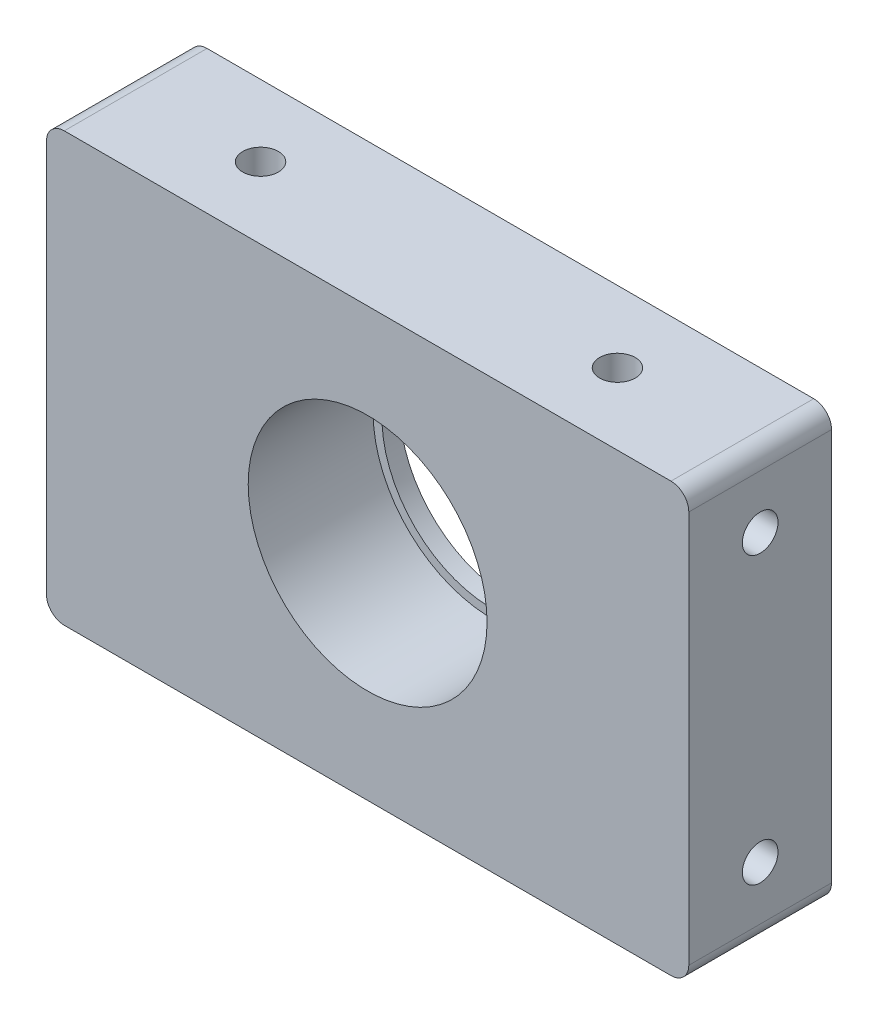
from build123d import *

# Parameters (mm, degrees)
BOSS_EXTRUDE1_DEPTH = 25.4
SKETCH2_R           = 42.50055
CUT_EXTRUDE1_DEPTH  = 44.45
SKETCH3_R           = 39.37
CUT_EXTRUDE2_DEPTH  = 31.75
SKETCH4_R           = 6.35
CUT_EXTRUDE3_DEPTH  = 19.05
CUT_EXTRUDE4_START  = -19.05
SKETCH5_R           = 6.35
CUT_EXTRUDE4_DEPTH  = 19.05
SKETCH6_R           = 6.35
CUT_EXTRUDE5_DEPTH  = 19.05
CUT_EXTRUDE6_START  = -19.05
SKETCH7_R           = 6.35
CUT_EXTRUDE6_DEPTH  = 19.05


with BuildPart() as part:
    # Sketch1 → Boss-Extrude1 (new, symmetric)
    with BuildSketch(Plane.XY):
        with BuildLine():
            Line((-107.95, -76.2), (107.95, -76.2))
            ThreePointArc((107.95, -76.2), (112.440128061, -74.340128061), (114.3, -69.85))
            Line((114.3, -69.85), (114.3, 69.85))
            ThreePointArc((114.3, 69.85), (112.440128061, 74.340128061), (107.95, 76.2))
            Line((107.95, 76.2), (-107.95, 76.2))
            ThreePointArc((-107.95, 76.2), (-112.440128061, 74.340128061), (-114.3, 69.85))
            Line((-114.3, 69.85), (-114.3, -69.85))
            ThreePointArc((-114.3, -69.85), (-112.440128061, -74.340128061), (-107.95, -76.2))
        make_face()
    extrude(amount=BOSS_EXTRUDE1_DEPTH, both=True)

    # Sketch2 → Cut-Extrude1 (cut)
    with BuildSketch(Plane.XY.offset(25.4)):
        Circle(SKETCH2_R)
    extrude(amount=-CUT_EXTRUDE1_DEPTH, mode=Mode.SUBTRACT)

    # Sketch3 → Cut-Extrude2 (cut)
    with BuildSketch(Plane.XY.offset(-19.05)):
        Circle(SKETCH3_R)
    extrude(amount=-CUT_EXTRUDE2_DEPTH, mode=Mode.SUBTRACT)

    # Sketch4 → Cut-Extrude3 (cut)
    with BuildSketch(Plane(origin=(0, 76.2, 0), x_dir=(1, 0, 0), z_dir=(0, 1, 0))):
        with Locations(Location((-63.5, 0, 0), (0, 0, 270))):
            Circle(SKETCH4_R)
        with Locations(Location((63.5, 0, 0), (0, 0, 270))):
            Circle(SKETCH4_R)
    extrude(amount=-CUT_EXTRUDE3_DEPTH, mode=Mode.SUBTRACT)

    # Sketch5 → Cut-Extrude4 (cut)
    with BuildSketch(Plane.XZ.offset(76.2).offset(CUT_EXTRUDE4_START)):
        with Locations(Location((-63.5, 0, 0), (0, 0, 90))):
            Circle(SKETCH5_R)
        with Locations(Location((63.5, 0, 0), (0, 0, 90))):
            Circle(SKETCH5_R)
    extrude(amount=CUT_EXTRUDE4_DEPTH, mode=Mode.SUBTRACT)

    # Sketch6 → Cut-Extrude5 (cut)
    with BuildSketch(Plane(origin=(114.3, 0, 0), x_dir=(0, 0, -1), z_dir=(1, 0, 0))):
        with Locations((0, 50.8)):
            Circle(SKETCH6_R)
        with Locations((0, -50.8)):
            Circle(SKETCH6_R)
    extrude(amount=-CUT_EXTRUDE5_DEPTH, mode=Mode.SUBTRACT)

    # Sketch7 → Cut-Extrude6 (cut)
    with BuildSketch(Plane.ZY.offset(114.3).offset(CUT_EXTRUDE6_START)):
        with Locations(Location((0, 50.8, 0), (0, 0, 180))):
            Circle(SKETCH7_R)
        with Locations(Location((0, -50.8, 0), (0, 0, 180))):
            Circle(SKETCH7_R)
    extrude(amount=CUT_EXTRUDE6_DEPTH, mode=Mode.SUBTRACT)


solid = part.part
